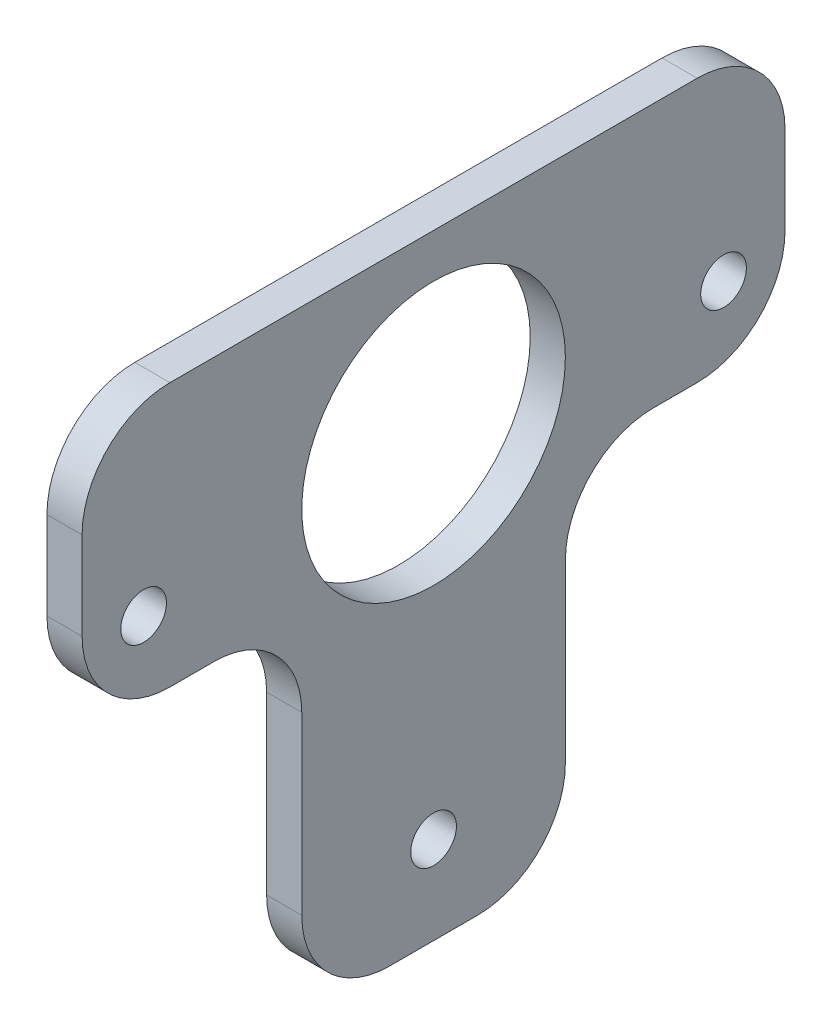
from build123d import *

# Parameters (mm, degrees)
BOSS_EXTRUDE1_DEPTH = 4
SKETCH2_R           = 15
SKETCH2_R_2         = 2.6
CUT_EXTRUDE1_DEPTH  = 5
FILLET1_R           = 10


with BuildPart() as part:
    # Sketch1 → Boss-Extrude1 (new body)
    with BuildSketch(Plane(origin=(0, 0, 0), x_dir=(0, 0, -1), z_dir=(1, 0, 0))):
        Polygon((-40, -15), (-15, -15), (-15, -55), (15, -55), (15, -15), (40, -15), (40, 15), (-40, 15), align=None)
    extrude(amount=BOSS_EXTRUDE1_DEPTH)

    # Sketch2 → Cut-Extrude1 (cut)
    with BuildSketch(Plane(origin=(4, 0, 0), x_dir=(0, 0, -1), z_dir=(1, 0, 0))):
        with Locations((0, -5)):
            Circle(SKETCH2_R)
        with Locations((0, -45)):
            Circle(SKETCH2_R_2)
        with Locations((-33, -6.5)):
            Circle(SKETCH2_R_2)
        with Locations((33, -6.5)):
            Circle(SKETCH2_R_2)
    extrude(amount=-CUT_EXTRUDE1_DEPTH, mode=Mode.SUBTRACT)

    # Fillet1
    fillet1_edges = [part.edges().sort_by_distance(p)[0] for p in [
        (2, 15, 40),
        (2, 15, -40),
        (2, -15, -40),
        (2, -15, -15),
        (2, -55, -15),
        (2, -55, 15),
        (2, -15, 15),
        (2, -15, 40),
    ]]
    fillet(fillet1_edges, radius=FILLET1_R)


solid = part.part
